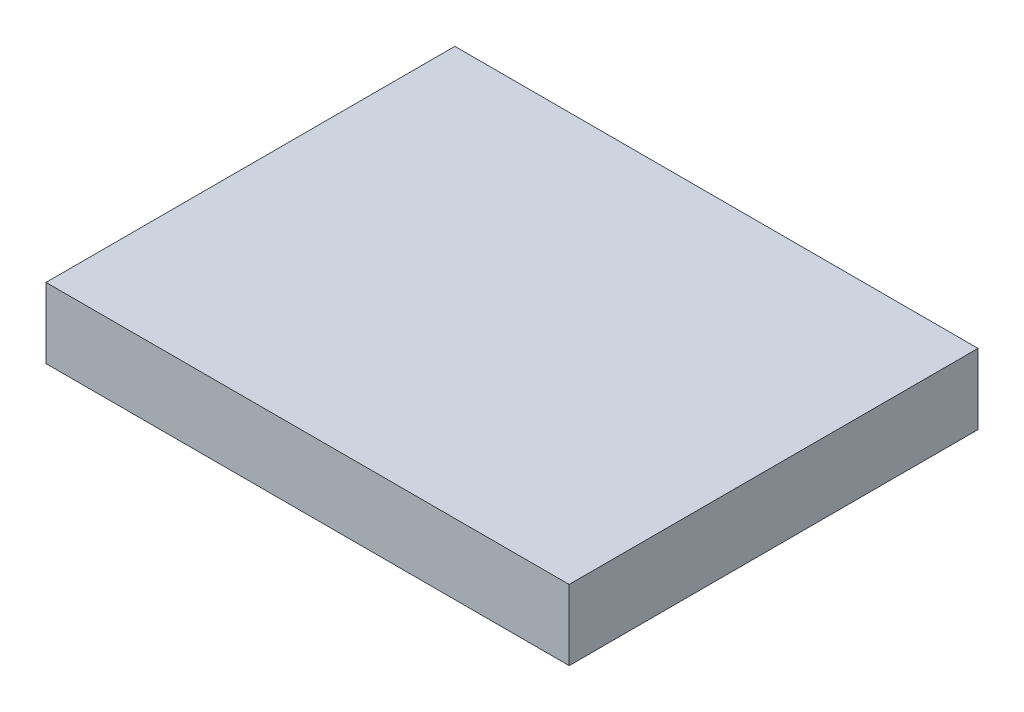
from build123d import *

# Parameters (mm, degrees)
SKETCH1_W           = 119
SKETCH1_H           = 93
BOSS_EXTRUDE1_DEPTH = 16


with BuildPart() as part:
    # Sketch1 → Boss-Extrude1 (new body)
    with BuildSketch(Plane(origin=(0, 0, 0), x_dir=(1, 0, 0), z_dir=(0, 1, 0))):
        Rectangle(SKETCH1_W, SKETCH1_H)
    extrude(amount=BOSS_EXTRUDE1_DEPTH)


solid = part.part
